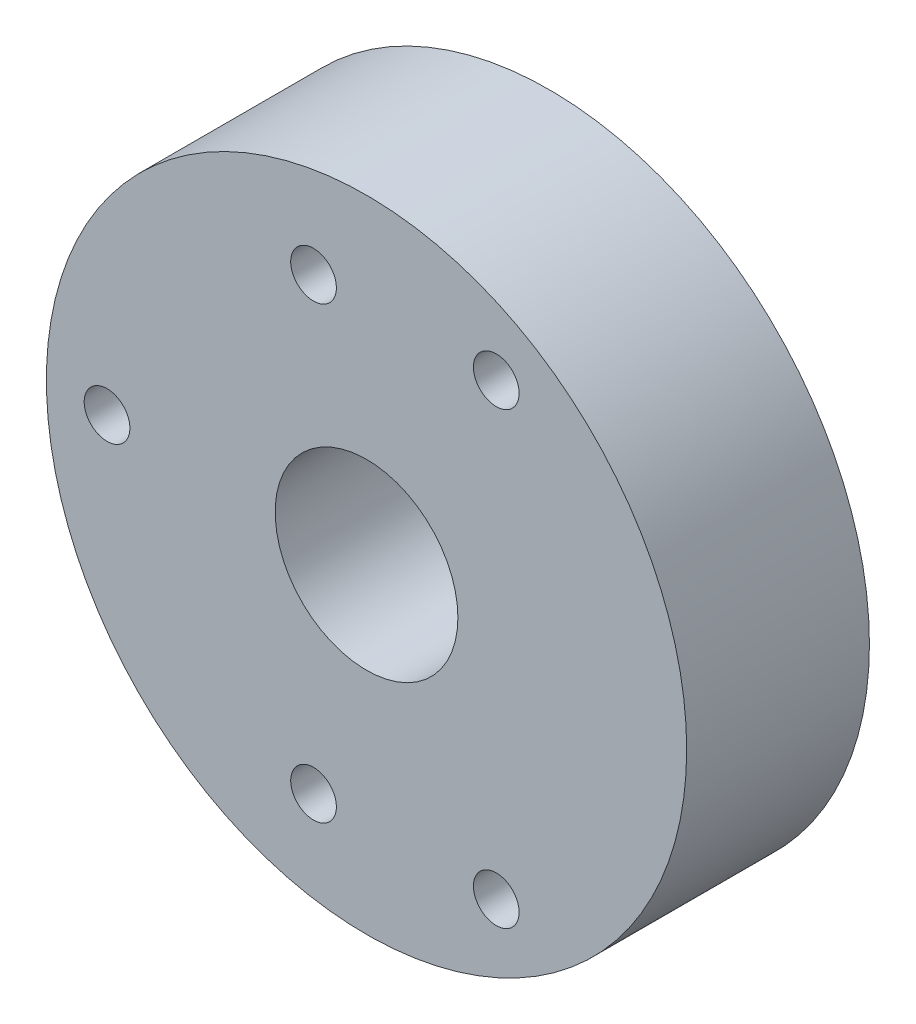
from build123d import *

# Parameters (mm, degrees)
SKETCH1_R           = 44.500262214
SKETCH1_R_2         = 12.7
SKETCH1_R_3         = 3.175
BOSS_EXTRUDE1_DEPTH = 25.4
SKETCH2_R           = 3.175
CUT_EXTRUDE1_DEPTH  = 25.4


with BuildPart() as part:
    # Sketch1 → Boss-Extrude1 (new body)
    with BuildSketch(Plane.XY):
        Circle(SKETCH1_R)
        Circle(SKETCH1_R_2, mode=Mode.SUBTRACT)
        with Locations((-36.068, 0)):
            Circle(SKETCH1_R_3, mode=Mode.SUBTRACT)
        with Locations((18.034, 31.235804264)):
            Circle(SKETCH1_R_3, mode=Mode.SUBTRACT)
        with Locations((18.034, -31.235804264)):
            Circle(SKETCH1_R_3, mode=Mode.SUBTRACT)
    extrude(amount=BOSS_EXTRUDE1_DEPTH)

    # Sketch2 → Cut-Extrude1 (cut)
    with BuildSketch(Plane.XY.offset(25.4)):
        with Locations((-7.366, -31.235804264)):
            Circle(SKETCH2_R)
        with Locations((-7.366, 31.235804264)):
            Circle(SKETCH2_R)
    extrude(amount=-CUT_EXTRUDE1_DEPTH, mode=Mode.SUBTRACT)


solid = part.part
